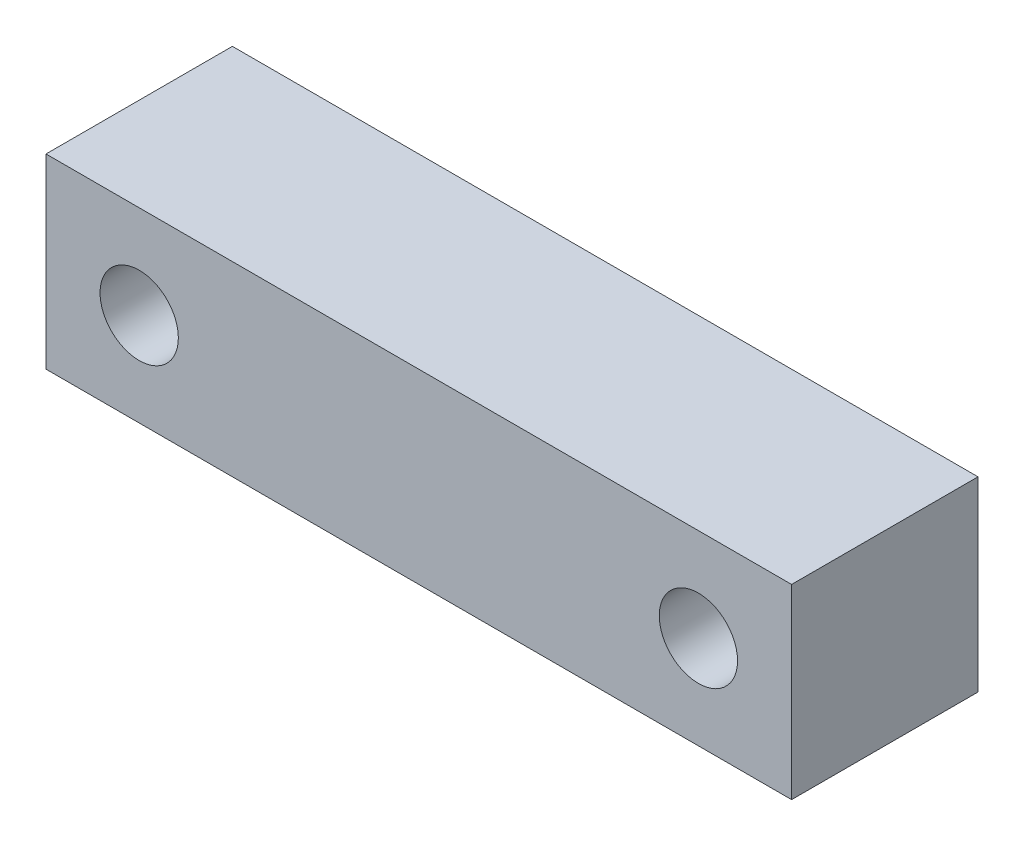
from build123d import *

# Parameters (mm, degrees)
SKETCH1_W           = 40
SKETCH1_H           = 10
SKETCH1_R           = 2.1
BOSS_EXTRUDE1_DEPTH = 10


with BuildPart() as part:
    # Sketch1 → Boss-Extrude1 (new body)
    with BuildSketch(Plane.XY):
        Rectangle(SKETCH1_W, SKETCH1_H)
        with Locations((-15, 0)):
            Circle(SKETCH1_R, mode=Mode.SUBTRACT)
        with Locations((15, 0)):
            Circle(SKETCH1_R, mode=Mode.SUBTRACT)
    extrude(amount=BOSS_EXTRUDE1_DEPTH)


solid = part.part
